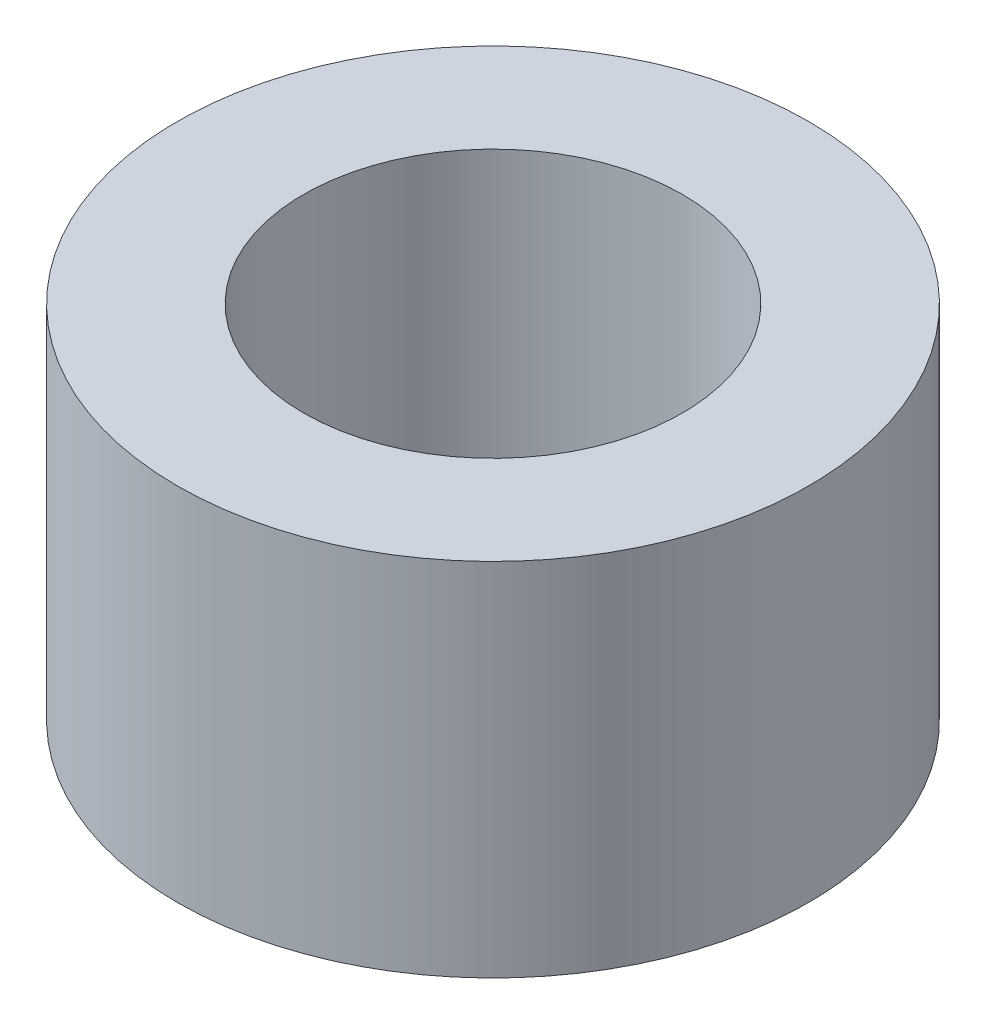
from build123d import *

# Parameters (mm, degrees)
SKETCH_1_R      = 3.5
SKETCH_1_R_2    = 2.1
EXTRUDE_1_DEPTH = 4


with BuildPart() as part:
    # 草图1 → 凸台-拉伸1 (new body)
    with BuildSketch(Plane(origin=(0, 0, 0), x_dir=(1, 0, 0), z_dir=(0, 1, 0))):
        with Locations(Location((0, 0, 0), (0, 0, 270))):
            Circle(SKETCH_1_R)
        with Locations(Location((0, 0, 0), (0, 0, 270))):
            Circle(SKETCH_1_R_2, mode=Mode.SUBTRACT)
    extrude(amount=EXTRUDE_1_DEPTH)


solid = part.part
